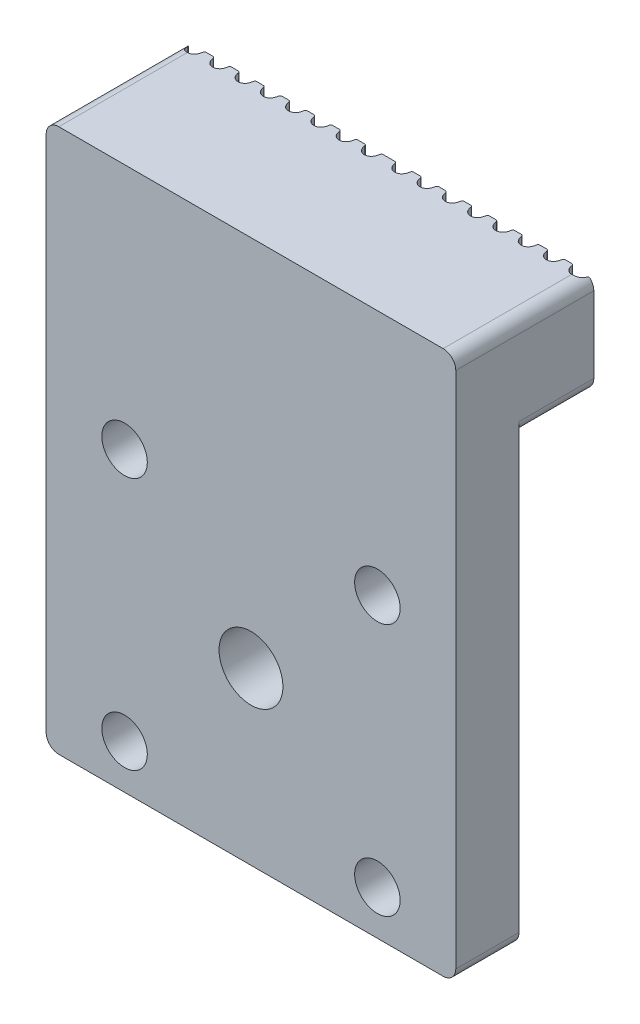
from build123d import *

# Parameters (mm, degrees)
SKETCH1_W            = 32.4
SKETCH1_H            = 27
BOSS_EXTRUDE1_DEPTH  = 5
M3_CLEARANCE_HOLE1_D = 3.6
SKETCH10_R           = 2.5273
CUT_EXTRUDE5_DEPTH   = 22.672332593
BOSS_EXTRUDE2_DEPTH  = 32.4
CUT_EXTRUDE6_DEPTH   = 8
LPATTERN1_COUNT      = 4
LPATTERN1_PITCH      = 4
MIRROR1_COPY_1_DEPTH = 8
MIRROR1_COPY_2_DEPTH = 8
MIRROR1_COPY_3_DEPTH = 8
SKETCH14_W           = 0.4
SKETCH14_H           = 0.63
CUT_EXTRUDE7_DEPTH   = 8
FILLET1_R            = 1


with BuildPart() as part:
    # Sketch1 → Boss-Extrude1 (new body)
    with BuildSketch(Plane.XY):
        Rectangle(SKETCH1_W, SKETCH1_H)
    extrude(amount=BOSS_EXTRUDE1_DEPTH)

    # M3 Clearance Hole1 (through all)
    with Locations(Plane.XY.offset(5)):
        with Locations((10, -10), (-10, -10), (-10, 10), (10, 10)):
            Hole(M3_CLEARANCE_HOLE1_D / 2)

    # Sketch10 → Cut-Extrude5 (cut, through all)
    with BuildSketch(Plane(origin=(0, 0, 0), x_dir=(-1, 0, 0), z_dir=(0, 0, -1))):
        Circle(SKETCH10_R)
    extrude(amount=-CUT_EXTRUDE5_DEPTH, mode=Mode.SUBTRACT)

    # Sketch11 → Boss-Extrude2 (add)
    with BuildSketch(Plane(origin=(16.2, 0, 0), x_dir=(0, 0, -1), z_dir=(1, 0, 0))):
        Polygon((-5, 13.5), (-5, 29.5), (6.55, 29.5), (6.55, 21.5), (0, 21.5), (0, 13.5), align=None)
    extrude(amount=-BOSS_EXTRUDE2_DEPTH)

    # Sketch13 → Cut-Extrude6 (cut)
    with BuildSketch(Plane(origin=(0, 29.5, 0), x_dir=(1, 0, 0), z_dir=(0, 1, 0))):
        with BuildLine():
            Line((-16.2, 6.55), (-12.2, 6.55))
            Line((-12.2, 6.55), (-12.2, 5.92))
            Line((-12.2, 5.92), (-12.459824575, 5.92))
            ThreePointArc((-12.459824575, 5.92), (-12.558731646, 5.882771412), (-12.608543109, 5.789565217))
            ThreePointArc((-12.608543109, 5.789565217), (-12.642388286, 5.631937846), (-12.701123596, 5.481797753))
            ThreePointArc((-12.701123596, 5.481797753), (-13.2, 5.17), (-13.698876404, 5.481797753))
            ThreePointArc((-13.698876404, 5.481797753), (-13.757611714, 5.631937846), (-13.791456891, 5.789565217))
            ThreePointArc((-13.791456891, 5.789565217), (-13.841268354, 5.882771412), (-13.940175425, 5.92))
            Line((-13.940175425, 5.92), (-14.459824575, 5.92))
            ThreePointArc((-14.459824575, 5.92), (-14.558731646, 5.882771412), (-14.608543109, 5.789565217))
            ThreePointArc((-14.608543109, 5.789565217), (-14.642388286, 5.631937846), (-14.701123596, 5.481797753))
            ThreePointArc((-14.701123596, 5.481797753), (-15.2, 5.17), (-15.698876404, 5.481797753))
            ThreePointArc((-15.698876404, 5.481797753), (-15.757611714, 5.631937846), (-15.791456891, 5.789565217))
            ThreePointArc((-15.791456891, 5.789565217), (-15.841268354, 5.882771412), (-15.940175425, 5.92))
            Line((-15.940175425, 5.92), (-16.2, 5.92))
            Line((-16.2, 5.92), (-16.2, 6.55))
        make_face()
    cut_extrude6 = extrude(amount=-CUT_EXTRUDE6_DEPTH, mode=Mode.SUBTRACT)

    # LPattern1: Cut-Extrude6 ×4
    with Locations(*[(i * LPATTERN1_PITCH, 0, 0) for i in range(1, LPATTERN1_COUNT)]):
        add(cut_extrude6, mode=Mode.SUBTRACT)

    # Mirror1: Cut-Extrude6 across plane
    add(cut_extrude6.mirror(Plane(origin=(0, 0, 0), x_dir=(0, 0, 1), z_dir=(1, 0, 0))), mode=Mode.SUBTRACT)

    # Mirror1 copy 1 sketch → Mirror1 copy 1 (cut)
    with BuildSketch(Plane(origin=(-4, 29.5, 0), x_dir=(-1, 0, 0), z_dir=(0, 1, 0))):
        with BuildLine():
            Line((-16.2, -6.55), (-12.2, -6.55))
            Line((-12.2, -6.55), (-12.2, -5.92))
            Line((-12.2, -5.92), (-12.459824575, -5.92))
            ThreePointArc((-12.459824575, -5.92), (-12.558731646, -5.882771412), (-12.608543109, -5.789565217))
            ThreePointArc((-12.608543109, -5.789565217), (-12.642388286, -5.631937846), (-12.701123596, -5.481797753))
            ThreePointArc((-12.701123596, -5.481797753), (-13.2, -5.17), (-13.698876404, -5.481797753))
            ThreePointArc((-13.698876404, -5.481797753), (-13.757611714, -5.631937846), (-13.791456891, -5.789565217))
            ThreePointArc((-13.791456891, -5.789565217), (-13.841268354, -5.882771412), (-13.940175425, -5.92))
            Line((-13.940175425, -5.92), (-14.459824575, -5.92))
            ThreePointArc((-14.459824575, -5.92), (-14.558731646, -5.882771412), (-14.608543109, -5.789565217))
            ThreePointArc((-14.608543109, -5.789565217), (-14.642388286, -5.631937846), (-14.701123596, -5.481797753))
            ThreePointArc((-14.701123596, -5.481797753), (-15.2, -5.17), (-15.698876404, -5.481797753))
            ThreePointArc((-15.698876404, -5.481797753), (-15.757611714, -5.631937846), (-15.791456891, -5.789565217))
            ThreePointArc((-15.791456891, -5.789565217), (-15.841268354, -5.882771412), (-15.940175425, -5.92))
            Line((-15.940175425, -5.92), (-16.2, -5.92))
            Line((-16.2, -5.92), (-16.2, -6.55))
        make_face()
    extrude(amount=-MIRROR1_COPY_1_DEPTH, mode=Mode.SUBTRACT)

    # Mirror1 copy 2 sketch → Mirror1 copy 2 (cut)
    with BuildSketch(Plane(origin=(-8, 29.5, 0), x_dir=(-1, 0, 0), z_dir=(0, 1, 0))):
        with BuildLine():
            Line((-16.2, -6.55), (-12.2, -6.55))
            Line((-12.2, -6.55), (-12.2, -5.92))
            Line((-12.2, -5.92), (-12.459824575, -5.92))
            ThreePointArc((-12.459824575, -5.92), (-12.558731646, -5.882771412), (-12.608543109, -5.789565217))
            ThreePointArc((-12.608543109, -5.789565217), (-12.642388286, -5.631937846), (-12.701123596, -5.481797753))
            ThreePointArc((-12.701123596, -5.481797753), (-13.2, -5.17), (-13.698876404, -5.481797753))
            ThreePointArc((-13.698876404, -5.481797753), (-13.757611714, -5.631937846), (-13.791456891, -5.789565217))
            ThreePointArc((-13.791456891, -5.789565217), (-13.841268354, -5.882771412), (-13.940175425, -5.92))
            Line((-13.940175425, -5.92), (-14.459824575, -5.92))
            ThreePointArc((-14.459824575, -5.92), (-14.558731646, -5.882771412), (-14.608543109, -5.789565217))
            ThreePointArc((-14.608543109, -5.789565217), (-14.642388286, -5.631937846), (-14.701123596, -5.481797753))
            ThreePointArc((-14.701123596, -5.481797753), (-15.2, -5.17), (-15.698876404, -5.481797753))
            ThreePointArc((-15.698876404, -5.481797753), (-15.757611714, -5.631937846), (-15.791456891, -5.789565217))
            ThreePointArc((-15.791456891, -5.789565217), (-15.841268354, -5.882771412), (-15.940175425, -5.92))
            Line((-15.940175425, -5.92), (-16.2, -5.92))
            Line((-16.2, -5.92), (-16.2, -6.55))
        make_face()
    extrude(amount=-MIRROR1_COPY_2_DEPTH, mode=Mode.SUBTRACT)

    # Mirror1 copy 3 sketch → Mirror1 copy 3 (cut)
    with BuildSketch(Plane(origin=(-12, 29.5, 0), x_dir=(-1, 0, 0), z_dir=(0, 1, 0))):
        with BuildLine():
            Line((-16.2, -6.55), (-12.2, -6.55))
            Line((-12.2, -6.55), (-12.2, -5.92))
            Line((-12.2, -5.92), (-12.459824575, -5.92))
            ThreePointArc((-12.459824575, -5.92), (-12.558731646, -5.882771412), (-12.608543109, -5.789565217))
            ThreePointArc((-12.608543109, -5.789565217), (-12.642388286, -5.631937846), (-12.701123596, -5.481797753))
            ThreePointArc((-12.701123596, -5.481797753), (-13.2, -5.17), (-13.698876404, -5.481797753))
            ThreePointArc((-13.698876404, -5.481797753), (-13.757611714, -5.631937846), (-13.791456891, -5.789565217))
            ThreePointArc((-13.791456891, -5.789565217), (-13.841268354, -5.882771412), (-13.940175425, -5.92))
            Line((-13.940175425, -5.92), (-14.459824575, -5.92))
            ThreePointArc((-14.459824575, -5.92), (-14.558731646, -5.882771412), (-14.608543109, -5.789565217))
            ThreePointArc((-14.608543109, -5.789565217), (-14.642388286, -5.631937846), (-14.701123596, -5.481797753))
            ThreePointArc((-14.701123596, -5.481797753), (-15.2, -5.17), (-15.698876404, -5.481797753))
            ThreePointArc((-15.698876404, -5.481797753), (-15.757611714, -5.631937846), (-15.791456891, -5.789565217))
            ThreePointArc((-15.791456891, -5.789565217), (-15.841268354, -5.882771412), (-15.940175425, -5.92))
            Line((-15.940175425, -5.92), (-16.2, -5.92))
            Line((-16.2, -5.92), (-16.2, -6.55))
        make_face()
    extrude(amount=-MIRROR1_COPY_3_DEPTH, mode=Mode.SUBTRACT)

    # Sketch14 → Cut-Extrude7 (cut)
    with BuildSketch(Plane(origin=(0, 29.5, 0), x_dir=(1, 0, 0), z_dir=(0, 1, 0))):
        with Locations((0, 6.235)):
            Rectangle(SKETCH14_W, SKETCH14_H)
    extrude(amount=-CUT_EXTRUDE7_DEPTH, mode=Mode.SUBTRACT)

    # Fillet1
    fillet1_edges = [part.edges().sort_by_distance(p)[0] for p in [
        (16.2, 21.5, -2.96),
        (16.2, 29.5, -0.46),
        (-16.2, 29.5, -0.46),
        (-16.2, 21.5, -2.96),
        (-16.2, -13.5, 2.5),
        (16.2, -13.5, 2.5),
    ]]
    fillet(fillet1_edges, radius=FILLET1_R)


solid = part.part
